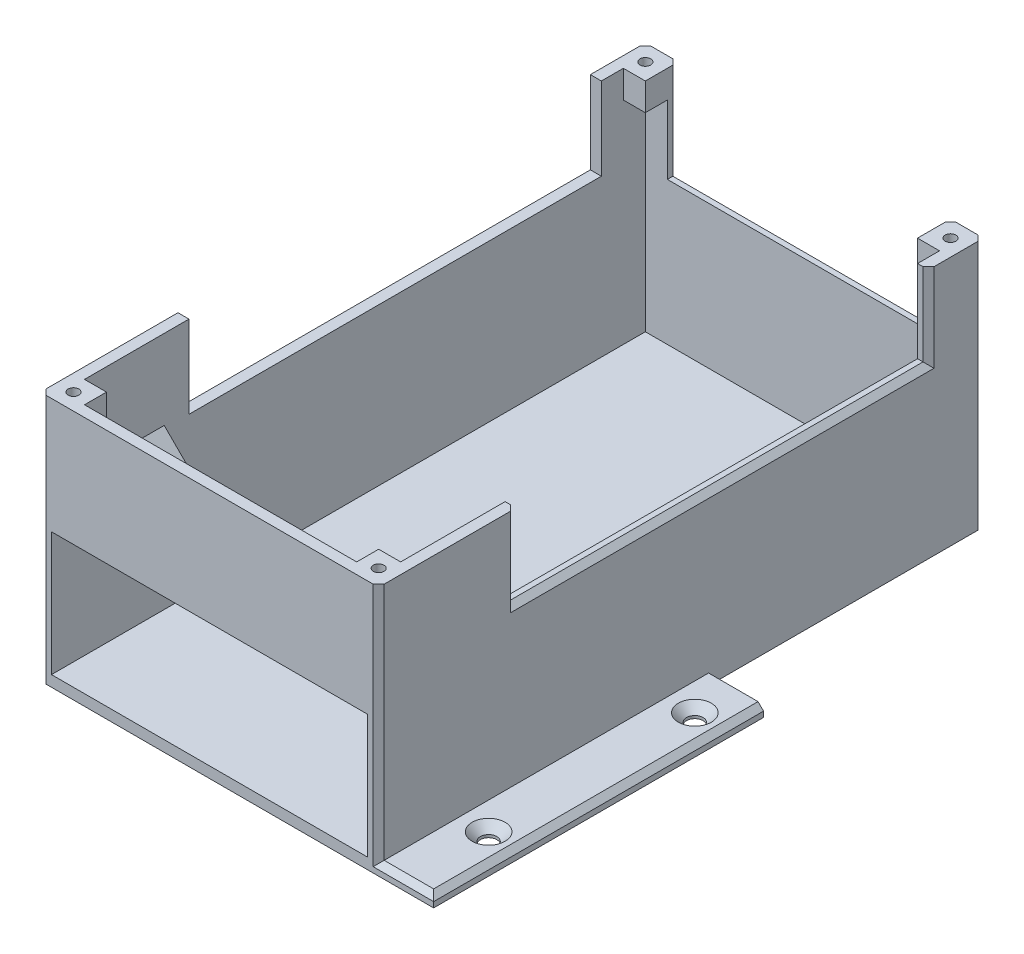
from build123d import *

# Parameters (mm, degrees)
SKETCH1_W           = 123
SKETCH1_H           = 220
BOSS_EXTRUDE1_DEPTH = 4
SKETCH2_W           = 123
SKETCH2_H           = 220
SKETCH2_W_2         = 115
SKETCH2_H_2         = 212
BOSS_EXTRUDE2_DEPTH = 87
CUT_EXTRUDE1_REACH  = 269.974
SKETCH3_W           = 115
SKETCH3_H           = 45
SKETCH4_W           = 150
SKETCH4_H           = 30
CUT_EXTRUDE2_DEPTH  = 268.973879324
SKETCH6_W           = 24
SKETCH6_H           = 37
SKETCH6_R           = 1.45
BOSS_EXTRUDE4_DEPTH = 3
SKETCH8_W           = 12
SKETCH8_H           = 12
BOSS_EXTRUDE5_DEPTH = 10
CUT_EXTRUDE3_REACH  = 269.974
SKETCH9_R           = 1.95
CUT_EXTRUDE4_REACH  = 269.974
SKETCH10_W          = 99
SKETCH10_H          = 35
CHAMFER1_SIZE       = 10
SKETCH11_W          = 20
SKETCH11_H          = 120
SKETCH11_R          = 3
BOSS_EXTRUDE6_DEPTH = 4
CHAMFER3_SIZE       = 2
CHAMFER4_SIZE       = 3


with BuildPart() as part:
    # Sketch1 → Boss-Extrude1 (new body)
    with BuildSketch(Plane(origin=(0, 0, 0), x_dir=(1, 0, 0), z_dir=(0, 1, 0))):
        with Locations((61.5, 110)):
            Rectangle(SKETCH1_W, SKETCH1_H)
    extrude(amount=BOSS_EXTRUDE1_DEPTH)

    # Sketch2 → Boss-Extrude2 (add)
    with BuildSketch(Plane(origin=(0, 4, 0), x_dir=(1, 0, 0), z_dir=(0, 1, 0))):
        with Locations((61.5, 110)):
            Rectangle(SKETCH2_W, SKETCH2_H)
        with Locations((61.5, 110)):
            Rectangle(SKETCH2_W_2, SKETCH2_H_2, mode=Mode.SUBTRACT)
    extrude(amount=BOSS_EXTRUDE2_DEPTH)

    # Sketch3 → Cut-Extrude1 (cut, up to next)
    with BuildSketch(Plane.XY, mode=Mode.PRIVATE) as cut_extrude1_sk1:
        with Locations((61.5, 26.5)):
            Rectangle(SKETCH3_W, SKETCH3_H)
    cut_extrude1_tool1 = extrude(cut_extrude1_sk1.sketch, amount=-CUT_EXTRUDE1_REACH, mode=Mode.PRIVATE) & part.part
    add(cut_extrude1_tool1.solids().sort_by_distance((61.5, 26.5, 0))[0], mode=Mode.SUBTRACT)

    # Sketch4 → Cut-Extrude2 (cut, through all)
    with BuildSketch(Plane(origin=(123, 0, 0), x_dir=(0, 0, -1), z_dir=(1, 0, 0))):
        with Locations((125, 76)):
            Rectangle(SKETCH4_W, SKETCH4_H)
    extrude(amount=-CUT_EXTRUDE2_DEPTH, mode=Mode.SUBTRACT)

    # Sketch6 → Boss-Extrude4 (add)
    # profile 1 of 2: a face of its own
    with BuildSketch(Plane(origin=(0, 49, 0), x_dir=(-1, 0, 0), z_dir=(0, -1, 0))):
        with Locations((-16, 22.5)):
            Rectangle(SKETCH6_W, SKETCH6_H)
        with Locations(Location((-25, 27.5, 0), (0, 0, 90))):
            Circle(SKETCH6_R, mode=Mode.SUBTRACT)
        with Locations(Location((-25, 17.5, 0), (0, 0, 270))):
            Circle(SKETCH6_R, mode=Mode.SUBTRACT)
    # profile 2 of 2: a face of its own
    with BuildSketch(Plane(origin=(0, 49, 0), x_dir=(-1, 0, 0), z_dir=(0, -1, 0))):
        with Locations((-107, 22.5)):
            Rectangle(SKETCH6_W, SKETCH6_H)
        with Locations(Location((-98, 17.5, 0), (0, 0, 90))):
            Circle(SKETCH6_R, mode=Mode.SUBTRACT)
        with Locations(Location((-98, 27.5, 0), (0, 0, 270))):
            Circle(SKETCH6_R, mode=Mode.SUBTRACT)
    extrude(amount=-BOSS_EXTRUDE4_DEPTH)

    # Sketch8 → Boss-Extrude5 (add)
    with BuildSketch(Plane(origin=(0, 91, 0), x_dir=(1, 0, 0), z_dir=(0, 1, 0))):
        with Locations((117, 214)):
            Rectangle(SKETCH8_W, SKETCH8_H)
        with Locations((6, 214)):
            Rectangle(SKETCH8_W, SKETCH8_H)
        with Locations((117, 6)):
            Rectangle(SKETCH8_W, SKETCH8_H)
        with Locations((6, 6)):
            Rectangle(SKETCH8_W, SKETCH8_H)
    extrude(amount=-BOSS_EXTRUDE5_DEPTH)

    # Sketch9 → Cut-Extrude3 (cut, up to next)
    with BuildSketch(Plane(origin=(0, 91, 0), x_dir=(1, 0, 0), z_dir=(0, 1, 0)), mode=Mode.PRIVATE) as cut_extrude3_sk1:
        with Locations(Location((6, 214, 0), (0, 0, 270))):
            Circle(SKETCH9_R)
    cut_extrude3_tool1 = extrude(cut_extrude3_sk1.sketch, amount=-CUT_EXTRUDE3_REACH, mode=Mode.PRIVATE) & part.part
    # Sketch9 → Cut-Extrude3 (cut, up to next)
    with BuildSketch(Plane(origin=(0, 91, 0), x_dir=(1, 0, 0), z_dir=(0, 1, 0)), mode=Mode.PRIVATE) as cut_extrude3_sk2:
        with Locations(Location((117, 214, 0), (0, 0, 90))):
            Circle(SKETCH9_R)
    cut_extrude3_tool2 = extrude(cut_extrude3_sk2.sketch, amount=-CUT_EXTRUDE3_REACH, mode=Mode.PRIVATE) & part.part
    # Sketch9 → Cut-Extrude3 (cut, up to next)
    with BuildSketch(Plane(origin=(0, 91, 0), x_dir=(1, 0, 0), z_dir=(0, 1, 0)), mode=Mode.PRIVATE) as cut_extrude3_sk3:
        with Locations(Location((117, 6, 0), (0, 0, 270))):
            Circle(SKETCH9_R)
    cut_extrude3_tool3 = extrude(cut_extrude3_sk3.sketch, amount=-CUT_EXTRUDE3_REACH, mode=Mode.PRIVATE) & part.part
    # Sketch9 → Cut-Extrude3 (cut, up to next)
    with BuildSketch(Plane(origin=(0, 91, 0), x_dir=(1, 0, 0), z_dir=(0, 1, 0)), mode=Mode.PRIVATE) as cut_extrude3_sk4:
        with Locations(Location((6, 6, 0), (0, 0, 90))):
            Circle(SKETCH9_R)
    cut_extrude3_tool4 = extrude(cut_extrude3_sk4.sketch, amount=-CUT_EXTRUDE3_REACH, mode=Mode.PRIVATE) & part.part
    add(cut_extrude3_tool1.solids().sort_by_distance((6, 91, -214))[0], mode=Mode.SUBTRACT)
    add(cut_extrude3_tool2.solids().sort_by_distance((117, 91, -214))[0], mode=Mode.SUBTRACT)
    add(cut_extrude3_tool3.solids().sort_by_distance((117, 91, -6))[0], mode=Mode.SUBTRACT)
    add(cut_extrude3_tool4.solids().sort_by_distance((6, 91, -6))[0], mode=Mode.SUBTRACT)

    # Sketch10 → Cut-Extrude4 (cut, up to next)
    with BuildSketch(Plane(origin=(0, 0, -220), x_dir=(-1, 0, 0), z_dir=(0, 0, -1)), mode=Mode.PRIVATE) as cut_extrude4_sk1:
        with Locations((-61.5, 73.5)):
            Rectangle(SKETCH10_W, SKETCH10_H)
    cut_extrude4_tool1 = extrude(cut_extrude4_sk1.sketch, amount=-CUT_EXTRUDE4_REACH, mode=Mode.PRIVATE) & part.part
    add(cut_extrude4_tool1.solids().sort_by_distance((61.5, 73.5, -220))[0], mode=Mode.SUBTRACT)

    # Chamfer1
    chamfer1_edges = [part.edges().sort_by_distance(p)[0] for p in [
        (119, 52, -22.5),
        (4, 52, -22.5),
    ]]
    chamfer(chamfer1_edges, length=CHAMFER1_SIZE)

    # Sketch11 → Boss-Extrude6 (add)
    with BuildSketch(Plane.XZ):
        with Locations((133, -60)):
            Rectangle(SKETCH11_W, SKETCH11_H)
        with Locations(Location((133, -105, 0), (0, 0, 270))):
            Circle(SKETCH11_R, mode=Mode.SUBTRACT)
        with Locations(Location((133, -30, 0), (0, 0, 270))):
            Circle(SKETCH11_R, mode=Mode.SUBTRACT)
    extrude(amount=-BOSS_EXTRUDE6_DEPTH)

    # Chamfer3
    chamfer3_edges = [part.edges().sort_by_distance(p)[0] for p in [
        (111, 73.5, -220),
        (61.5, 56, -220),
        (12, 73.5, -220),
        (133, 4, 0),
        (143, 4, -60),
        (123, 76, -50),
        (123, 61, -125),
        (123, 76, -200),
        (0, 45.5, -220),
        (123, 45.5, -220),
        (123, 47.5, 0),
        (0, 45.5, 0),
    ]]
    chamfer(chamfer3_edges, length=CHAMFER3_SIZE)

    # Chamfer4
    chamfer4_edges = [part.edges().sort_by_distance(p)[0] for p in [
        (133, 4, -102),
        (133, 4, -27),
    ]]
    chamfer(chamfer4_edges, length=CHAMFER4_SIZE)


solid = part.part
